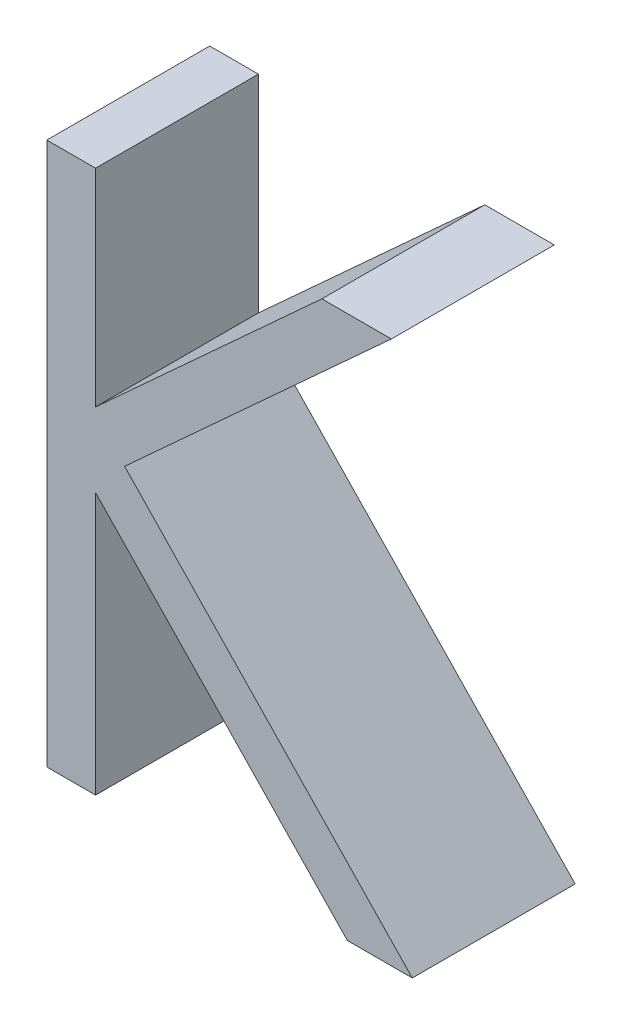
from build123d import *

# Parameters (mm, degrees)
BOSS_EXTRU_1_DEPTH = 1.5


with BuildPart() as part:
    # Esquisse1 → Boss.-Extru.1 (new body)
    with BuildSketch(Plane.XY):
        Polygon((-55.432465326, -17.870119076), (-54.983747377, -17.870119076), (-54.983747377, -19.774165551), (-52.899412441, -17.870119076), (-52.259388403, -17.870119076), (-54.716319493, -20.11370882), (-52.06708071, -22.870119076), (-52.665037441, -22.870119076), (-54.983747377, -20.457258499), (-54.983747377, -22.870119076), (-55.432465326, -22.870119076), align=None)
    extrude(amount=BOSS_EXTRU_1_DEPTH)


solid = part.part
